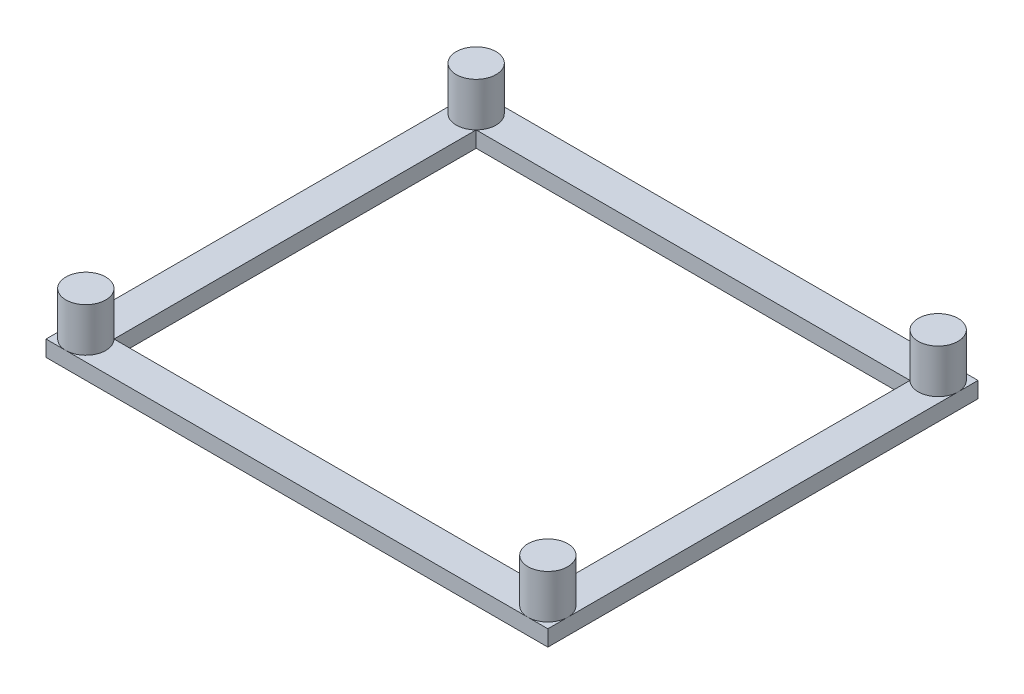
from build123d import *

# Parameters (mm, degrees)
SKETCH4_R           = 2.5
SKETCH4_R_2         = 1.8415
BOSS_EXTRUDE4_DEPTH = 7.5
SKETCH5_W           = 63
SKETCH5_H           = 54
SKETCH5_W_2         = 54.464466094
SKETCH5_H_2         = 45.464466094
BOSS_EXTRUDE5_DEPTH = 2


with BuildPart() as part:
    # Sketch4 → Boss-Extrude4 (new body)
    # profile 1 of 8: a face of its own
    with BuildSketch(Plane(origin=(0, 0, 0), x_dir=(1, 0, 0), z_dir=(0, 1, 0))):
        with Locations(Location((58, 0, 0), (0, 0, 270))):
            Circle(SKETCH4_R)
        with Locations((58, 0)):
            Circle(SKETCH4_R_2, mode=Mode.SUBTRACT)
    # profile 2 of 8: a face of its own
    with BuildSketch(Plane(origin=(0, 0, 0), x_dir=(1, 0, 0), z_dir=(0, 1, 0))):
        with Locations((58, 0)):
            Circle(SKETCH4_R_2)
    # profile 3 of 8: a face of its own
    with BuildSketch(Plane(origin=(0, 0, 0), x_dir=(1, 0, 0), z_dir=(0, 1, 0))):
        with Locations(Location((0, 0, 0), (0, 0, 270))):
            Circle(SKETCH4_R)
        Circle(SKETCH4_R_2, mode=Mode.SUBTRACT)
    # profile 4 of 8: a face of its own
    with BuildSketch(Plane(origin=(0, 0, 0), x_dir=(1, 0, 0), z_dir=(0, 1, 0))):
        Circle(SKETCH4_R_2)
    # profile 5 of 8: a face of its own
    with BuildSketch(Plane(origin=(0, 0, 0), x_dir=(1, 0, 0), z_dir=(0, 1, 0))):
        with Locations(Location((0, 49, 0), (0, 0, 270))):
            Circle(SKETCH4_R)
        with Locations((0, 49)):
            Circle(SKETCH4_R_2, mode=Mode.SUBTRACT)
    # profile 6 of 8: a face of its own
    with BuildSketch(Plane(origin=(0, 0, 0), x_dir=(1, 0, 0), z_dir=(0, 1, 0))):
        with Locations((0, 49)):
            Circle(SKETCH4_R_2)
    # profile 7 of 8: a face of its own
    with BuildSketch(Plane(origin=(0, 0, 0), x_dir=(1, 0, 0), z_dir=(0, 1, 0))):
        with Locations(Location((58, 49, 0), (0, 0, 270))):
            Circle(SKETCH4_R)
        with Locations((58, 49)):
            Circle(SKETCH4_R_2, mode=Mode.SUBTRACT)
    # profile 8 of 8: a face of its own
    with BuildSketch(Plane(origin=(0, 0, 0), x_dir=(1, 0, 0), z_dir=(0, 1, 0))):
        with Locations((58, 49)):
            Circle(SKETCH4_R_2)
    extrude(amount=BOSS_EXTRUDE4_DEPTH)

    # Sketch5 → Boss-Extrude5 (add)
    with BuildSketch(Plane.XZ):
        with Locations((29, -24.5)):
            Rectangle(SKETCH5_W, SKETCH5_H)
        with Locations((29, -24.5)):
            Rectangle(SKETCH5_W_2, SKETCH5_H_2, mode=Mode.SUBTRACT)
    extrude(amount=-BOSS_EXTRUDE5_DEPTH)


solid = part.part
